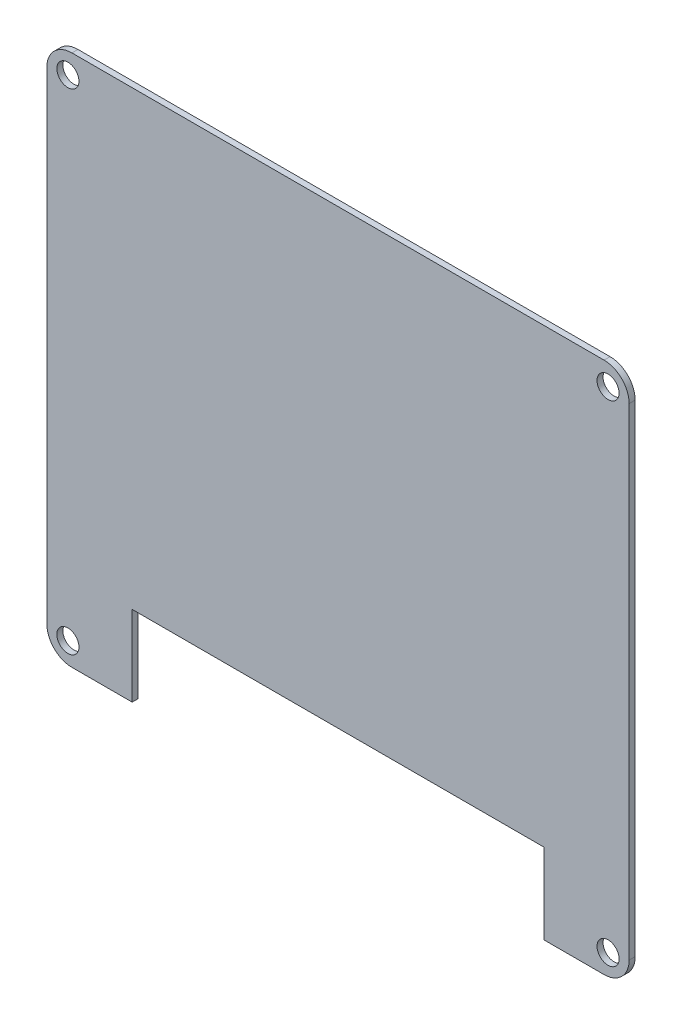
from build123d import *

# Parameters (mm, degrees)
SKETCH_1_R      = 1.1
EXTRUDE_1_DEPTH = 0.6


with BuildPart() as part:
    # 草图1 → 凸台-拉伸1 (new body)
    with BuildSketch(Plane.XY):
        with BuildLine():
            Line((-26.5, -26.5), (-20.5, -26.5))
            Line((-20.5, -26.5), (-20.5, -18.5))
            Line((-20.5, -18.5), (20.5, -18.5))
            Line((20.5, -18.5), (20.5, -26.5))
            Line((20.5, -26.5), (26.5, -26.5))
            ThreePointArc((26.5, -26.5), (28.267766953, -25.767766953), (29, -24))
            Line((29, -24), (29, 24))
            ThreePointArc((29, 24), (28.267766953, 25.767766953), (26.5, 26.5))
            Line((26.5, 26.5), (-26.5, 26.5))
            ThreePointArc((-26.5, 26.5), (-28.267766953, 25.767766953), (-29, 24))
            Line((-29, 24), (-29, -24))
            ThreePointArc((-29, -24), (-28.267766953, -25.767766953), (-26.5, -26.5))
        make_face()
        with Locations((-26.9, 24.4)):
            Circle(SKETCH_1_R, mode=Mode.SUBTRACT)
        with Locations(Location((-26.9, -24.4, 0), (0, 0, 180))):
            Circle(SKETCH_1_R, mode=Mode.SUBTRACT)
        with Locations((26.9, -24.4)):
            Circle(SKETCH_1_R, mode=Mode.SUBTRACT)
        with Locations(Location((26.9, 24.4, 0), (0, 0, 180))):
            Circle(SKETCH_1_R, mode=Mode.SUBTRACT)
    extrude(amount=EXTRUDE_1_DEPTH)


solid = part.part
